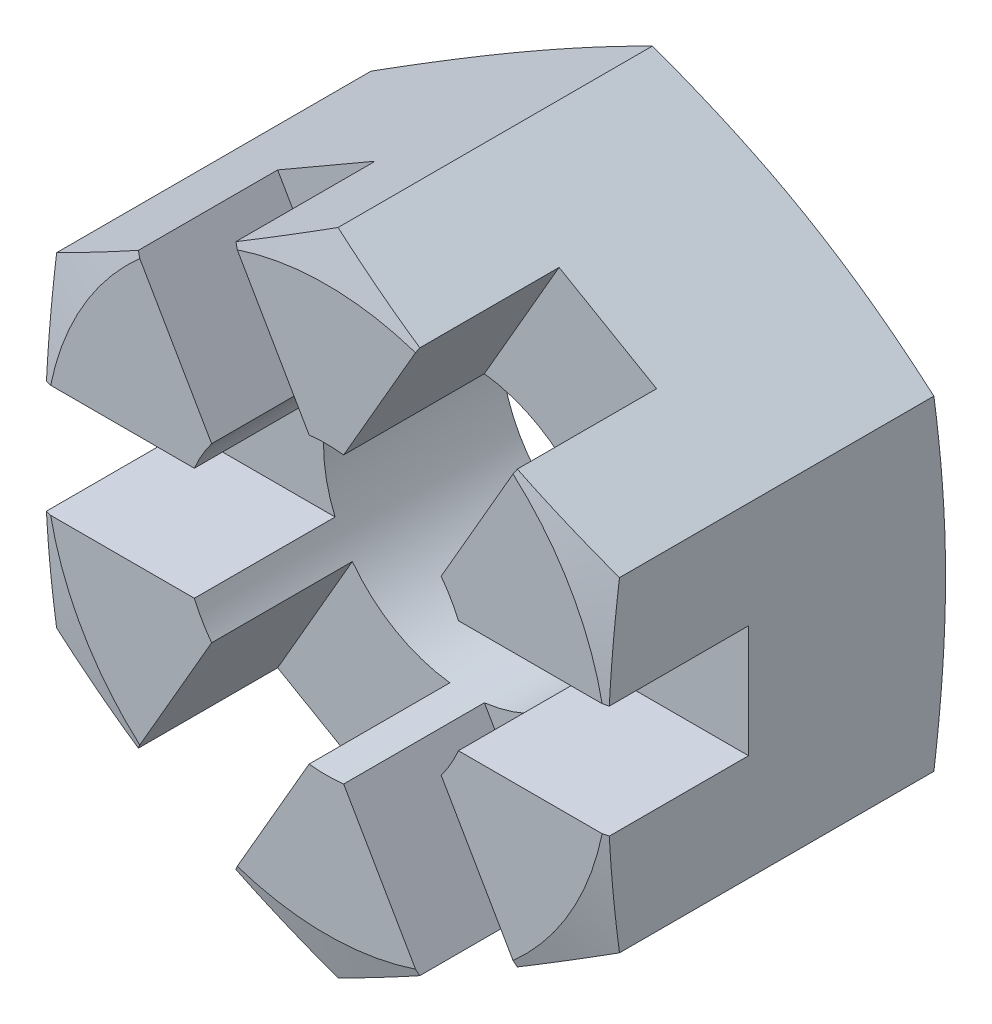
from build123d import *

# Parameters (mm, degrees)
VYSUNOUT1_DEPTH          = 6
SKICA4_R                 = 2.55
ODEBRAT_VYSUNUT_M1_DEPTH = 10.712534856
SKICA5_W                 = 10
SKICA5_H                 = 2
ODEBRAT_VYSUNUT_M2_DEPTH = 2.5
KRUHOV_POLE1_COUNT       = 3
ZKOSIT1_SIZE             = 0.6
ZKOSIT1_SIZE2            = 0.346410162


with BuildPart() as part:
    # Skica1 → Vysunout1 (new body)
    with BuildSketch(Plane.XY):
        Polygon((5, -2.886751346), (5, 2.886751346), (0, 5.773502692), (-5, 2.886751346), (-5, -2.886751346), (0, -5.773502692), align=None)
    extrude(amount=VYSUNOUT1_DEPTH)

    # Skica3 → Odebrat otočením1 (revolve, cut)
    with BuildSketch(Plane(origin=(0, 0, 0), x_dir=(1, 0, 0), z_dir=(0, 1, 0))):
        Polygon((-16.196152423, -3), (-5, 0), (-16.196152423, 0), align=None)
        Polygon((-5, -6), (-16.196152423, -3), (-16.196152423, -6), align=None)
    revolve(axis=Axis((0, 0, 0), (0, 0, 1)), mode=Mode.SUBTRACT)

    # Skica4 → Odebrat vysunutím1 (cut, through all)
    with BuildSketch(Plane(origin=(0, 0, 0), x_dir=(-1, 0, 0), z_dir=(0, 0, -1))):
        Circle(SKICA4_R)
    extrude(amount=-ODEBRAT_VYSUNUT_M1_DEPTH, mode=Mode.SUBTRACT)

    # Skica5 → Odebrat vysunutím2 (cut)
    with BuildSketch(Plane.XY.offset(6)):
        Rectangle(SKICA5_W, SKICA5_H)
    odebrat_vysunut_m2 = extrude(amount=-ODEBRAT_VYSUNUT_M2_DEPTH, mode=Mode.SUBTRACT)

    # Kruhové pole1: Odebrat vysunutím2 ×3 about axis
    kruhov_pole1_axis = Axis((0, 0, 0), (0, 0, 1))
    for i in range(1, KRUHOV_POLE1_COUNT):
        add(odebrat_vysunut_m2.rotate(kruhov_pole1_axis, i * 360 / KRUHOV_POLE1_COUNT), mode=Mode.SUBTRACT)

    # Zkosit1
    zkosit1_edges = [part.edges().sort_by_distance(p)[0] for p in [
        (2.55, 0, 0),
    ]]
    zkosit1_side = [part.faces().sort_by_distance(p)[0] for p in [
        (4.207652517, -2.429289347, 0),
    ]]
    chamfer(zkosit1_edges, length=ZKOSIT1_SIZE, length2=ZKOSIT1_SIZE2, reference=zkosit1_side[0])


solid = part.part
